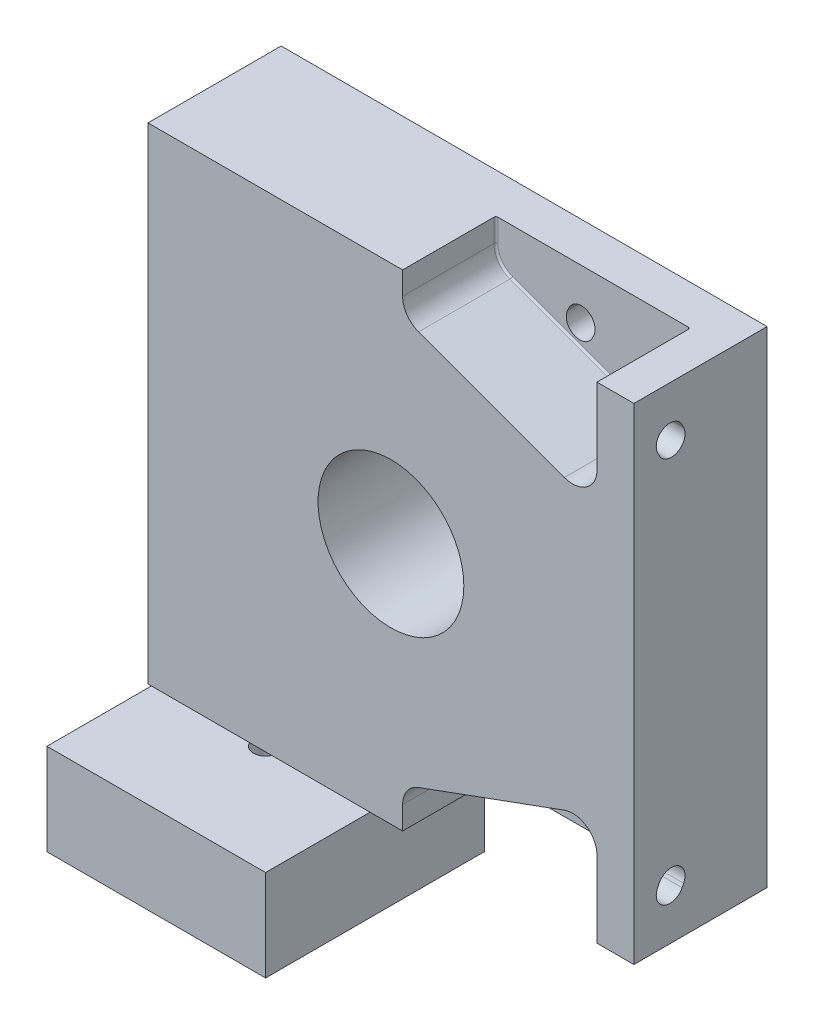
from build123d import *

# Parameters (mm, degrees)
SKETCH2_W                        = 127
SKETCH2_H                        = 127
HOUSING_DEPTH                    = 39.5
SKETCH4_OUTSIDE_W                = 165.78
SKETCH4_OUTSIDE_H                = 165.78
SKETCH4_OUTSIDE_R                = 45.974
CUT_EXTRUDE2_DEPTH               = 4.698
MOUNTING_POCKETS_DEPTH           = 24.384
ENG_METRIC_SLOT_VERTICAL_REACH   = 160.723
ENG_METRIC_SLOT_HORIZONTAL_DEPTH = 199.381065075
FILLET3_R                        = 0.508
SKETCH213_W                      = 57.15
SKETCH213_H                      = 57.15
EXTRUDE1_DEPTH                   = 26.924
SKETCH214_R                      = 23.8125
CUT_EXTRUDE3_DEPTH               = 5
SKETCH215_R                      = 3.175
CUT_EXTRUDE4_DEPTH               = 21.924
CUT_EXTRUDE5_REACH               = 170.363
SKETCH216_W                      = 42.545
SKETCH216_H                      = 3.048
F_8_32_TAPPED_HOLE1_D            = 3.4544
F_8_32_TAPPED_HOLE1_DEPTH        = 10.7086
F_8_32_TAPPED_HOLE1_TIP          = 1.037806461
SKETCH241_R                      = 45.974
CUT_EXTRUDE7_DEPTH               = 4.698
SKETCH3_R                        = 19.05
CUT_EXTRUDE8_DEPTH               = 122.723587102


with BuildPart() as part:
    # Sketch2 → HOUSING (new body)
    with BuildSketch(Plane.XY):
        Rectangle(SKETCH2_W, SKETCH2_H)
    extrude(amount=HOUSING_DEPTH)

    # Sketch4 outside → Cut-Extrude2 (cut)
    with BuildSketch(Plane.XY.offset(39.5)):
        Rectangle(SKETCH4_OUTSIDE_W, SKETCH4_OUTSIDE_H)
        Circle(SKETCH4_OUTSIDE_R, mode=Mode.SUBTRACT)
    extrude(amount=-CUT_EXTRUDE2_DEPTH, mode=Mode.SUBTRACT)

    # Sketch8 → MOUNTING POCKETS (cut)
    with BuildSketch(Plane.XY.offset(34.802)):
        with BuildLine():
            Line((3.048, -63.5), (3.048, -57.528018122))
            ThreePointArc((3.048, -57.528018122), (4.194729662, -53.888172274), (7.220748912, -51.562946647))
            Line((7.220748912, -51.562946647), (45.320748912, -37.656446647))
            ThreePointArc((45.320748912, -37.656446647), (51.137845848, -38.418247784), (53.848, -43.621518122))
            Line((53.848, -43.621518122), (53.848, -63.5))
            Line((53.848, -63.5), (3.048, -63.5))
        make_face()
        with BuildLine():
            Line((3.048, 63.5), (53.848, 63.5))
            Line((53.848, 63.5), (53.848, 43.621518122))
            ThreePointArc((53.848, 43.621518122), (51.137845848, 38.418247784), (45.320748912, 37.656446647))
            Line((45.320748912, 37.656446647), (7.220748912, 51.562946647))
            ThreePointArc((7.220748912, 51.562946647), (4.194729662, 53.888172274), (3.048, 57.528018122))
            Line((3.048, 57.528018122), (3.048, 63.5))
        make_face()
    extrude(amount=-MOUNTING_POCKETS_DEPTH, mode=Mode.SUBTRACT)

    # Sketch21 → ENG_METRIC SLOT VERTICAL (cut, up to next)
    with BuildSketch(Plane(origin=(63.5, -23.646142673, 1.166551585), x_dir=(0, 0, -1), z_dir=(1, 0, 0)), mode=Mode.PRIVATE) as eng_metric_slot_vertical_sk1:
        with BuildLine():
            Line((-20.641506099, 75.242113831), (-21.041506099, 76.042113831))
            ThreePointArc((-21.041506099, 76.042113831), (-25.829419573, 77.63808499), (-27.425390732, 72.850171515))
            Line((-27.425390732, 72.850171515), (-27.025390732, 72.050171515))
            ThreePointArc((-27.025390732, 72.050171515), (-22.237477257, 70.454200357), (-20.641506099, 75.242113831))
        make_face()
    eng_metric_slot_vertical_tool1 = extrude(eng_metric_slot_vertical_sk1.sketch, amount=-ENG_METRIC_SLOT_VERTICAL_REACH, mode=Mode.PRIVATE) & part.part
    # Sketch21 → ENG_METRIC SLOT VERTICAL (cut, up to next)
    with BuildSketch(Plane(origin=(63.5, -23.646142673, 1.166551585), x_dir=(0, 0, -1), z_dir=(1, 0, 0)), mode=Mode.PRIVATE) as eng_metric_slot_vertical_sk2:
        with BuildLine():
            Line((-27.025390732, -24.757886169), (-27.425390732, -25.557886169))
            ThreePointArc((-27.425390732, -25.557886169), (-25.829419573, -30.345799643), (-21.041506099, -28.749828485))
            Line((-21.041506099, -28.749828485), (-20.641506099, -27.949828485))
            ThreePointArc((-20.641506099, -27.949828485), (-22.237477257, -23.16191501), (-27.025390732, -24.757886169))
        make_face()
    eng_metric_slot_vertical_tool2 = extrude(eng_metric_slot_vertical_sk2.sketch, amount=-ENG_METRIC_SLOT_VERTICAL_REACH, mode=Mode.PRIVATE) & part.part
    add(eng_metric_slot_vertical_tool1.solids().sort_by_distance((63.5, 50.4, 25.2))[0], mode=Mode.SUBTRACT)
    add(eng_metric_slot_vertical_tool2.solids().sort_by_distance((63.5, -50.4, 25.2))[0], mode=Mode.SUBTRACT)

    # Sketch212 → ENG_METRIC SLOT HORIZONTAL (cut, through all)
    with BuildSketch(Plane(origin=(34.062086582, -104.655987826, 0), x_dir=(-1, 0, 0), z_dir=(0, 0, -1))):
        with BuildLine():
            Line((12.254028899, 156.251958985), (11.854028899, 157.051958985))
            ThreePointArc((11.854028899, 157.051958985), (7.066115424, 158.647930143), (5.470144266, 153.860016668))
            Line((5.470144266, 153.860016668), (5.870144266, 153.060016668))
            ThreePointArc((5.870144266, 153.060016668), (10.658057741, 151.46404551), (12.254028899, 156.251958985))
        make_face()
        with BuildLine():
            Line((5.870144266, 56.251958985), (5.470144266, 55.451958985))
            ThreePointArc((5.470144266, 55.451958985), (7.066115424, 50.66404551), (11.854028899, 52.260016668))
            Line((11.854028899, 52.260016668), (12.254028899, 53.060016668))
            ThreePointArc((12.254028899, 53.060016668), (10.658057741, 57.847930143), (5.870144266, 56.251958985))
        make_face()
    extrude(amount=-ENG_METRIC_SLOT_HORIZONTAL_DEPTH, mode=Mode.SUBTRACT)

    # Fillet3
    fillet3_edges = [part.edges().sort_by_distance(p)[0] for p in [
        (3.048, -60.514009061, 10.418),
        (4.194729662, -53.888172274, 10.418),
        (26.270748912, -44.609696647, 10.418),
        (51.137845848, -38.418247784, 10.418),
        (53.848, -53.560759061, 10.418),
        (51.137845848, 38.418247784, 10.418),
        (26.270748912, 44.609696647, 10.418),
        (4.194729662, 53.888172274, 10.418),
        (3.048, 60.514009061, 10.418),
        (53.848, 53.560759061, 10.418),
    ]]
    fillet(fillet3_edges, radius=FILLET3_R)

    # Sketch213 → Extrude1 (add)
    with BuildSketch(Plane.XZ.offset(63.5)):
        with Locations((-37.084, 30.48)):
            Rectangle(SKETCH213_W, SKETCH213_H)
    extrude(amount=EXTRUDE1_DEPTH)

    # Sketch214 → Cut-Extrude3 (cut)
    with BuildSketch(Plane.XZ.offset(90.424)):
        with Locations(Location((-37.084, 30.48, 0), (0, 0, 270))):
            Circle(SKETCH214_R)
    extrude(amount=-CUT_EXTRUDE3_DEPTH, mode=Mode.SUBTRACT)

    # Sketch215 → Cut-Extrude4 (cut)
    with BuildSketch(Plane.XZ.offset(85.424)):
        with Locations(Location((-37.084, 30.48, 0), (0, 0, 270))):
            Circle(SKETCH215_R)
    extrude(amount=-CUT_EXTRUDE4_DEPTH, mode=Mode.SUBTRACT)

    # Sketch216 → Cut-Extrude5 (cut, up to next)
    with BuildSketch(Plane.ZY.offset(65.659), mode=Mode.PRIVATE) as cut_extrude5_sk1:
        with Locations((37.7825, -65.024)):
            Rectangle(SKETCH216_W, SKETCH216_H)
    cut_extrude5_tool1 = extrude(cut_extrude5_sk1.sketch, amount=-CUT_EXTRUDE5_REACH, mode=Mode.PRIVATE) & part.part
    add(cut_extrude5_tool1.solids().sort_by_distance((-65.659, -65.024, 37.7825))[0], mode=Mode.SUBTRACT)

    # #8-32 Tapped Hole1
    with Locations(Plane.XZ.offset(90.424)):
        with Locations((-60.706, 6.858), (-60.706, 54.102), (-13.462, 54.102), (-13.462, 6.858)):
            Hole(F_8_32_TAPPED_HOLE1_D / 2, depth=F_8_32_TAPPED_HOLE1_DEPTH)
            with Locations((0, 0, -(F_8_32_TAPPED_HOLE1_DEPTH + F_8_32_TAPPED_HOLE1_TIP / 2))):  # 118° drill point
                Cone(0, F_8_32_TAPPED_HOLE1_D / 2, F_8_32_TAPPED_HOLE1_TIP, mode=Mode.SUBTRACT)

    # Sketch241 → Cut-Extrude7 (cut)
    with BuildSketch(Plane.XY.offset(39.5)):
        Circle(SKETCH241_R)
    extrude(amount=-CUT_EXTRUDE7_DEPTH, mode=Mode.SUBTRACT)

    # Sketch3 → Cut-Extrude8 (cut, through all)
    with BuildSketch(Plane.XY.offset(48.26)):
        Circle(SKETCH3_R)
    extrude(amount=-CUT_EXTRUDE8_DEPTH, mode=Mode.SUBTRACT)


solid = part.part
